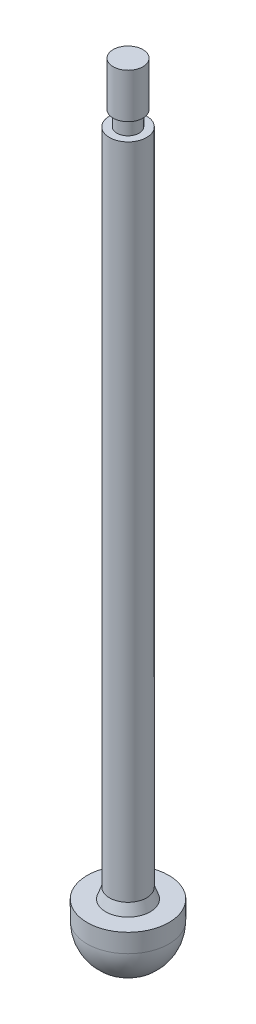
from build123d import *


with BuildPart() as part:
    # Sketch1 → Revolve1 (revolve)
    with BuildSketch(Plane.XY, mode=Mode.PRIVATE) as revolve1_sk:
        with BuildLine():
            Line((5.5, 0), (5.5, 2.5))
            Line((5.5, 2.5), (3, 2.5))
            Line((3, 2.5), (2.5, 3.87373871))
            Line((2.5, 3.87373871), (2.5, 92.5))
            Line((2.5, 92.5), (1.5, 92.5))
            Line((1.5, 92.5), (1.5, 94.5))
            Line((1.5, 94.5), (2, 94.5))
            Line((2, 94.5), (2, 100.5))
            Line((2, 100.5), (0, 100.5))
            Line((0, 100.5), (0, -5.5))
            ThreePointArc((0, -5.5), (3.889087297, -3.889087297), (5.5, 0))
        make_face()
    revolve(revolve1_sk.sketch.rotate(Axis((0, 0, 0), (0, 1, 0)), 90), axis=Axis((0, 0, 0), (0, 1, 0)))


solid = part.part
